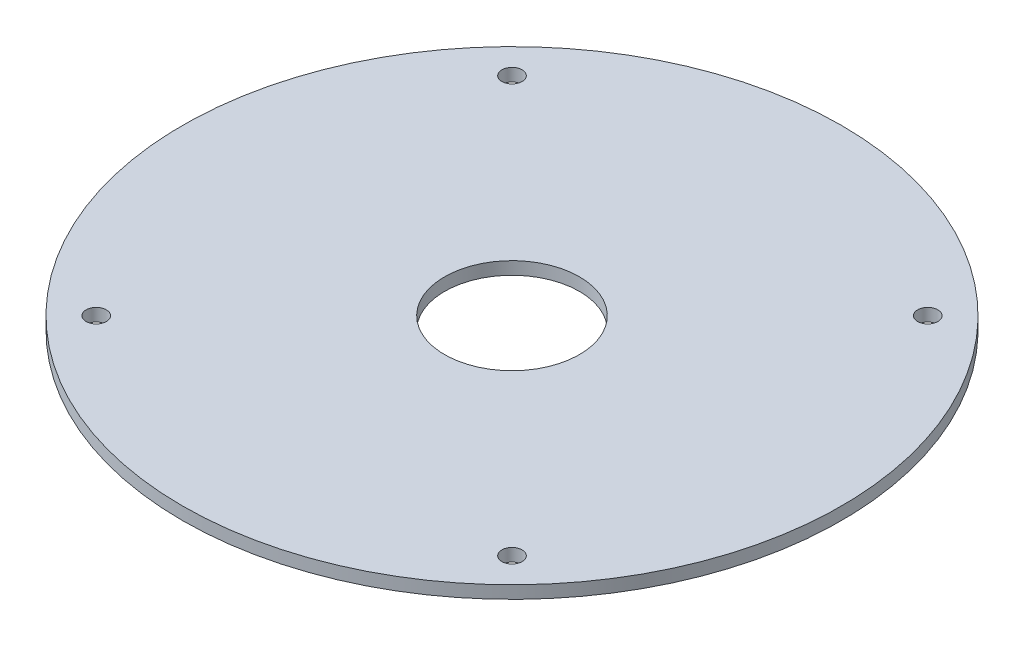
from build123d import *

# Parameters (mm, degrees)
SKETCH1_R           = 65
BOSS_EXTRUDE1_DEPTH = 2.5
SKETCH2_R           = 13.3
CUT_EXTRUDE1_DEPTH  = 92.957870789
SKETCH3_R           = 2
CUT_EXTRUDE2_DEPTH  = 92.957870789


with BuildPart() as part:
    # Sketch1 → Boss-Extrude1 (new body)
    with BuildSketch(Plane(origin=(0, 0, 0), x_dir=(1, 0, 0), z_dir=(0, 1, 0))):
        with Locations(Location((0, 0, 0), (0, 0, 270))):
            Circle(SKETCH1_R)
    extrude(amount=BOSS_EXTRUDE1_DEPTH)

    # Sketch2 → Cut-Extrude1 (cut, through all)
    with BuildSketch(Plane.XZ):
        with Locations(Location((0, 0, 0), (0, 0, 270))):
            Circle(SKETCH2_R)
    extrude(amount=-CUT_EXTRUDE1_DEPTH, mode=Mode.SUBTRACT)

    # Sketch3 → Cut-Extrude2 (cut, through all)
    with BuildSketch(Plane.XZ):
        with Locations(Location((-41, 41, 0), (0, 0, 270))):
            Circle(SKETCH3_R)
        with Locations(Location((41, 41, 0), (0, 0, 270))):
            Circle(SKETCH3_R)
        with Locations(Location((41, -41, 0), (0, 0, 270))):
            Circle(SKETCH3_R)
        with Locations(Location((-41, -41, 0), (0, 0, 270))):
            Circle(SKETCH3_R)
    extrude(amount=-CUT_EXTRUDE2_DEPTH, mode=Mode.SUBTRACT)


solid = part.part
